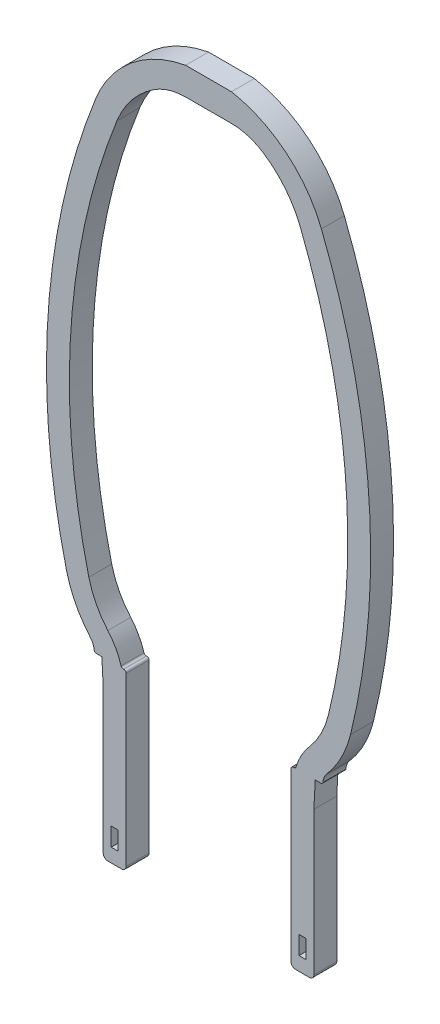
from build123d import *
from OCP.BRepFilletAPI import BRepFilletAPI_MakeChamfer

# Parameters (mm, degrees)
SKETCH1_W           = 1.5
SKETCH1_H           = 4
BOSS_EXTRUDE2_DEPTH = 5
FILLET1_R           = 0.5
CHAMFER1_SIZE       = 0.3
CHAMFER1_SIZE2      = 5.724341006
FILLET2_R           = 1


with BuildPart() as part:
    # Sketch1 → Boss-Extrude2 (new body)
    with BuildSketch(Plane.XY):
        with BuildLine():
            Line((-23, 0), (-23, -38))
            Line((-23, -38), (-18, -38))
            Line((-18, -38), (-18, 0))
            Line((-18, 0), (-19, 0))
            ThreePointArc((-19, 0), (-20.184067393, 2.97246837), (-22, 5.606851138))
            ThreePointArc((-22, 5.606851138), (-24.550960709, 9.359484468), (-26.147686675, 13.606851138))
            ThreePointArc((-26.147686675, 13.606851138), (-30.048729273, 58.796026105), (-20, 103.026136974))
            ThreePointArc((-20, 103.026136974), (-16.753739062, 108.568721435), (-12, 112.888491974))
            ThreePointArc((-12, 112.888491974), (-8.655764836, 114.460632304), (-5, 115))
            Line((-5, 115), (0, 115))
            Line((0, 115), (5, 115))
            ThreePointArc((5, 115), (8.655764836, 114.460632304), (12, 112.888491974))
            ThreePointArc((12, 112.888491974), (16.753739062, 108.568721435), (20, 103.026136974))
            ThreePointArc((20, 103.026136974), (30.048729273, 58.796026105), (26.147686675, 13.606851138))
            ThreePointArc((26.147686675, 13.606851138), (24.550960709, 9.359484468), (22, 5.606851138))
            ThreePointArc((22, 5.606851138), (20.184067393, 2.97246837), (19, 0))
            Line((19, 0), (18, 0))
            Line((18, 0), (18, -38))
            Line((18, -38), (23, -38))
            Line((23, -38), (23, 0))
            Line((23, 0), (25, 0))
            ThreePointArc((25, 0), (25.153863701, 1.240298929), (25.773026769, 2.325956595))
            ThreePointArc((25.773026769, 2.325956595), (28.989837998, 7.058100445), (31.003340596, 12.414112692))
            ThreePointArc((31.003340596, 12.414112692), (35.036954168, 59.138972746), (24.646734179, 104.872176375))
            ThreePointArc((24.646734179, 104.872176375), (20.63684435, 111.718561641), (14.764867241, 117.05448635))
            ThreePointArc((14.764867241, 117.05448635), (10.08229677, 119.521890335), (5, 121))
            Line((5, 121), (-5, 121))
            ThreePointArc((-5, 121), (-10.08229677, 119.521890335), (-14.764867241, 117.05448635))
            ThreePointArc((-14.764867241, 117.05448635), (-20.63684435, 111.718561641), (-24.646734179, 104.872176375))
            ThreePointArc((-24.646734179, 104.872176375), (-35.036954168, 59.138972746), (-31.003340596, 12.414112692))
            ThreePointArc((-31.003340596, 12.414112692), (-28.989837998, 7.058100445), (-25.773026769, 2.325956595))
            ThreePointArc((-25.773026769, 2.325956595), (-25.153863701, 1.240298929), (-25, 0))
            Line((-25, 0), (-23, 0))
        make_face()
        with Locations((-20.5, -33)):
            Rectangle(SKETCH1_W, SKETCH1_H, mode=Mode.SUBTRACT)
        with Locations((20.5, -33)):
            Rectangle(SKETCH1_W, SKETCH1_H, mode=Mode.SUBTRACT)
    extrude(amount=BOSS_EXTRUDE2_DEPTH)

    # Fillet1
    fillet1_edges = [part.edges().sort_by_distance(p)[0] for p in [
        (-25, 0, 2.5),
        (25, 0, 2.5),
        (18, 0, 2.5),
        (19, 0, 2.5),
        (-19, 0, 2.5),
        (-18, 0, 2.5),
    ]]
    fillet(fillet1_edges, radius=FILLET1_R)

    # Chamfer1: one chamfer whose edges measure the first distance from different faces: ONE call of the kernel's chamfer builder (chamfer() names one face for all edges)
    chamfer1_edges_1 = [part.edges().sort_by_distance(p)[0] for p in [
        (-23, 0, 2.5),
    ]]
    chamfer1_side_1 = [part.faces().sort_by_distance(p)[0] for p in [
        (-23.750387455, 0, 2.5),
    ]]
    chamfer1_edges_2 = [part.edges().sort_by_distance(p)[0] for p in [
        (23, 0, 2.5),
    ]]
    chamfer1_side_2 = [part.faces().sort_by_distance(p)[0] for p in [
        (23.750387455, 0, 2.5),
    ]]
    chamfer1 = BRepFilletAPI_MakeChamfer(part.part.solid().wrapped)
    for e in chamfer1_edges_1:
        chamfer1.Add(CHAMFER1_SIZE, CHAMFER1_SIZE2, e.wrapped, chamfer1_side_1[0].wrapped)  # the first distance lies on this face
    for e in chamfer1_edges_2:
        chamfer1.Add(CHAMFER1_SIZE, CHAMFER1_SIZE2, e.wrapped, chamfer1_side_2[0].wrapped)  # the first distance lies on this face
    add(Compound.cast(chamfer1.Shape()), mode=Mode.REPLACE)

    # Fillet2
    fillet2_edges = [part.edges().sort_by_distance(p)[0] for p in [
        (-18, -38, 2.5),
        (-23, -38, 2.5),
        (23, -38, 2.5),
        (18, -38, 2.5),
    ]]
    fillet(fillet2_edges, radius=FILLET2_R)


solid = part.part
